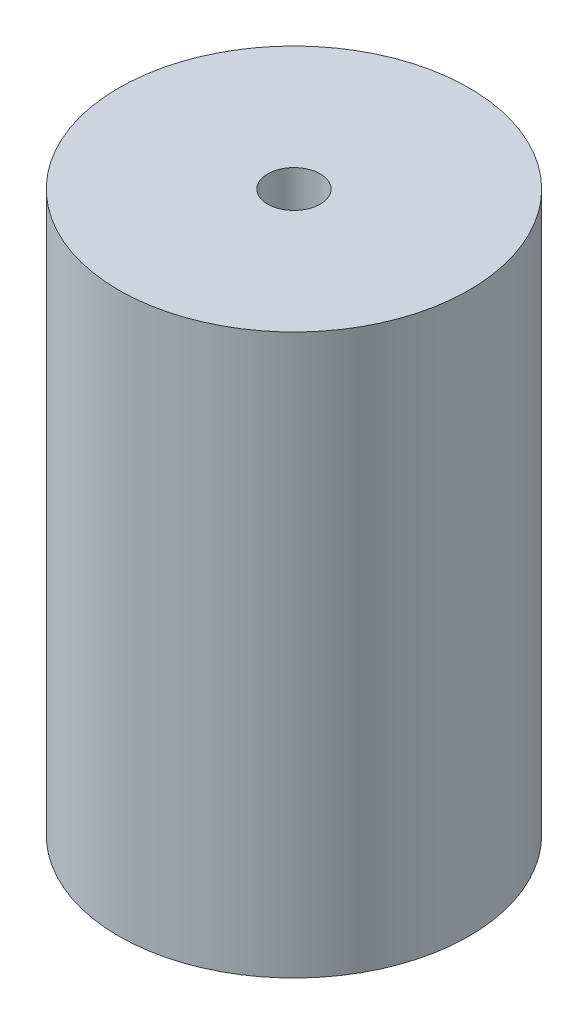
from build123d import *

# Parameters (mm, degrees)
SKETCH1_R           = 10
SKETCH1_R_2         = 1.5
BOSS_EXTRUDE1_DEPTH = 31.94


with BuildPart() as part:
    # Sketch1 → Boss-Extrude1 (new body)
    with BuildSketch(Plane(origin=(0, 0, 0), x_dir=(1, 0, 0), z_dir=(0, 1, 0))):
        with Locations(Location((0, 0, 0), (0, 0, 270))):
            Circle(SKETCH1_R)
        with Locations(Location((0, 0, 0), (0, 0, 270))):
            Circle(SKETCH1_R_2, mode=Mode.SUBTRACT)
    extrude(amount=BOSS_EXTRUDE1_DEPTH)


solid = part.part
